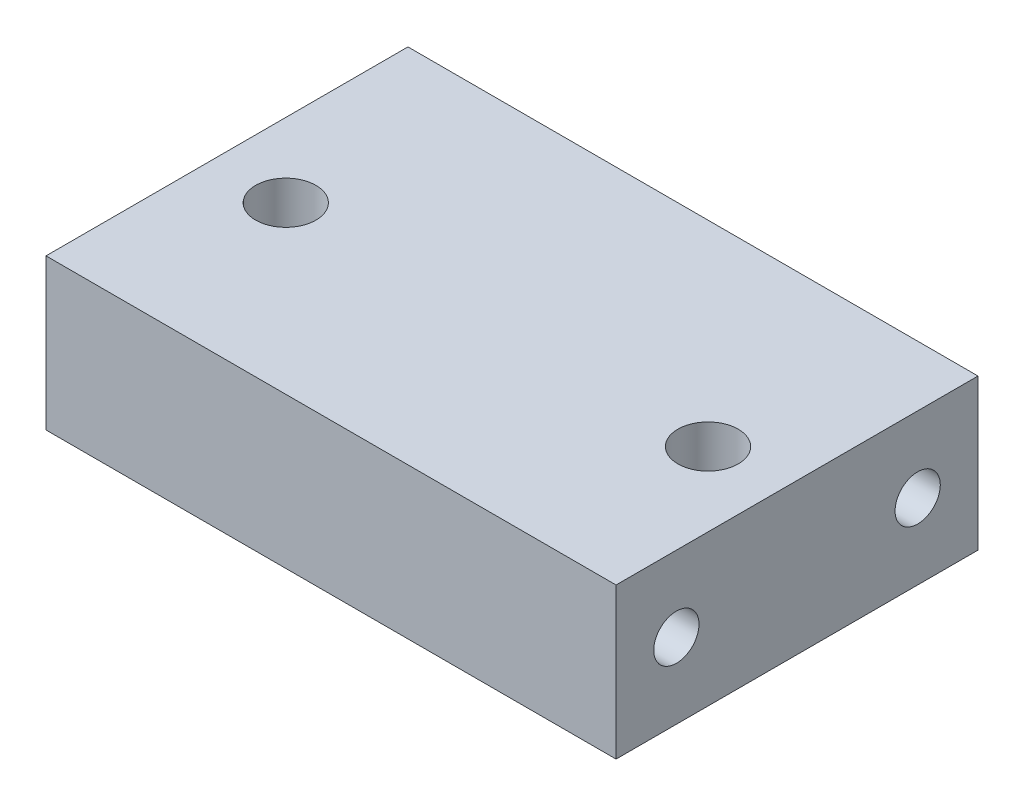
from build123d import *

# Parameters (mm, degrees)
SKETCH_1_W                  = 37.8
SKETCH_1_H                  = 24
EXTRUDE_1_DEPTH             = 10
HOLE_WIZARD_M4_1_AT_2_COUNT = 2
HOLE_WIZARD_M4_1_AT_2_PITCH = 28
HOLE_WIZARD_M3_1_AT_2_COUNT = 2
HOLE_WIZARD_M3_1_AT_2_PITCH = 16


with BuildPart() as part:
    # 草图1 → 凸台-拉伸1 (new body)
    with BuildSketch(Plane(origin=(0, 0, 0), x_dir=(1, 0, 0), z_dir=(0, 1, 0))):
        Rectangle(SKETCH_1_W, SKETCH_1_H)
    extrude(amount=EXTRUDE_1_DEPTH)

    # 草图5 → M4 螺纹孔1 (revolve, cut)
    with BuildSketch(Plane(origin=(-14, 10, 1), x_dir=(0, 0, 1), z_dir=(1, 0, 0))):
        Polygon((0, 0), (0, 8.491420021), (1.65, 7.5), (1.65, 8), (2, 8), (2, 0), align=None)
    hole_wizard_m4_1 = revolve(axis=Axis((-14, 16.35, 1), (0, -1, 0)), mode=Mode.SUBTRACT)

    # M4 螺纹孔1 at 2: M4 螺纹孔1 ×2
    with Locations(*[(i * HOLE_WIZARD_M4_1_AT_2_PITCH, 0, 0) for i in range(1, HOLE_WIZARD_M4_1_AT_2_COUNT)]):
        add(hole_wizard_m4_1, mode=Mode.SUBTRACT)

    # 草图6 → M3 螺纹孔1 (revolve, cut)
    with BuildSketch(Plane(origin=(18.9, 5, 8), x_dir=(0, 0, -1), z_dir=(0, 1, 0))):
        Polygon((0, 0), (0, 12.751075774), (1.25, 12), (1.25, 11.5), (1.5, 11.5), (1.5, 0), align=None)
    hole_wizard_m3_1 = revolve(axis=Axis((25.25, 5, 8), (-1, 0, 0)), mode=Mode.SUBTRACT)

    # M3 螺纹孔1 at 2: M3 螺纹孔1 ×2
    with Locations(*[(0, 0, -i * HOLE_WIZARD_M3_1_AT_2_PITCH) for i in range(1, HOLE_WIZARD_M3_1_AT_2_COUNT)]):
        add(hole_wizard_m3_1, mode=Mode.SUBTRACT)

    # 镜向1: M3 螺纹孔1 across plane
    add(hole_wizard_m3_1.mirror(Plane(origin=(0, 0, 0), x_dir=(0, 0, 1), z_dir=(1, 0, 0))), mode=Mode.SUBTRACT)

    # 镜向1 copy 1 sketch → 镜向1 copy 1 (revolve, cut)
    with BuildSketch(Plane(origin=(-18.9, 5, -8), x_dir=(0, 0, -1), z_dir=(0, 1, 0))):
        Polygon((0, 0), (0, -12.751075774), (1.25, -12), (1.25, -11.5), (1.5, -11.5), (1.5, 0), align=None)
    revolve(axis=Axis((-25.25, 5, -8), (-1, 0, 0)), mode=Mode.SUBTRACT)


solid = part.part
